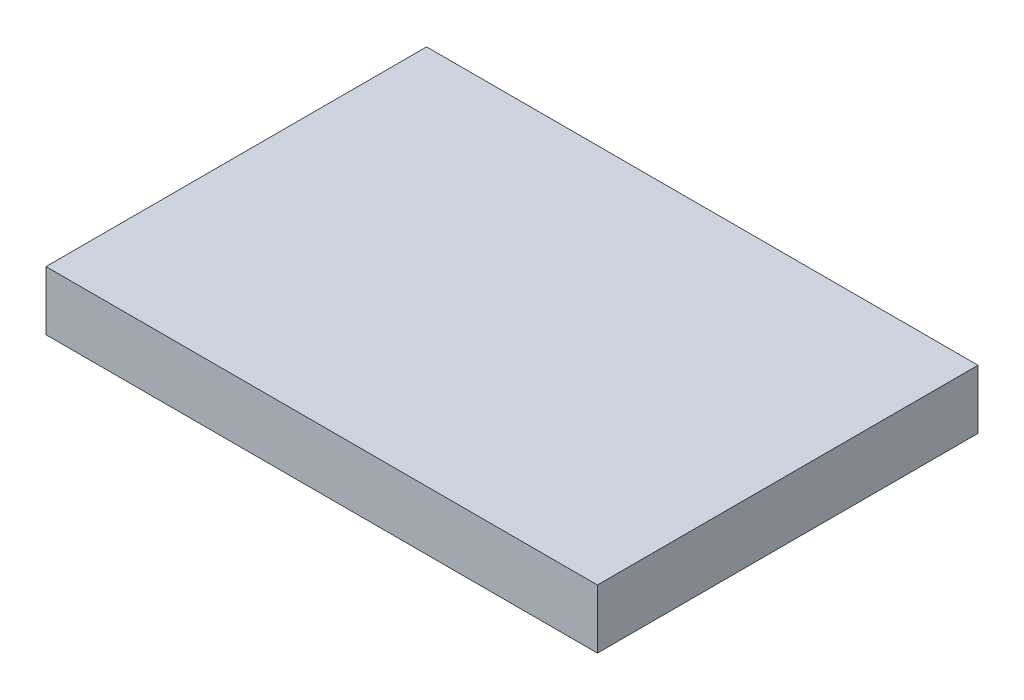
from build123d import *

# Parameters (mm, degrees)
SKETCH_1_W      = 35.5
SKETCH_1_H      = 24.5
EXTRUDE_1_DEPTH = 3.8


with BuildPart() as part:
    # Эскиз1 → Бобышка-Вытянуть1 (new body)
    with BuildSketch(Plane(origin=(0, 0, 0), x_dir=(1, 0, 0), z_dir=(0, 1, 0))):
        with Locations((17.75, -12.25)):
            Rectangle(SKETCH_1_W, SKETCH_1_H)
    extrude(amount=EXTRUDE_1_DEPTH)


solid = part.part
